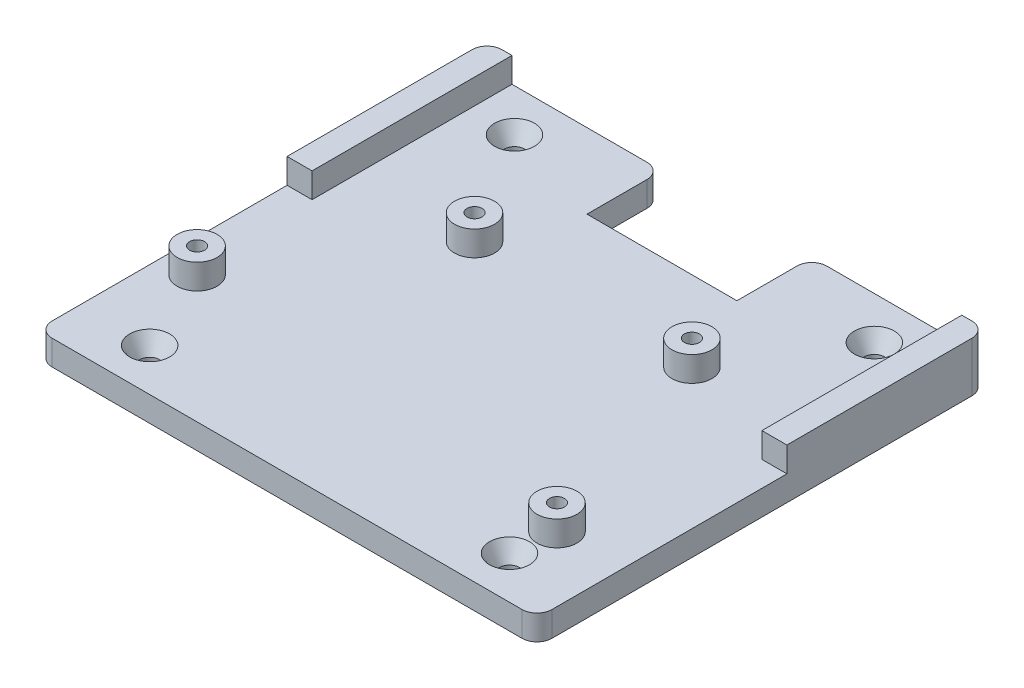
from build123d import *

# Parameters (mm, degrees)
CROQUIS1_R              = 2
SALIENTE_EXTRUIR2_DEPTH = 5
CHAFL_N1_SIZE           = 2
CHAFL_N1_SIZE2          = 3.464101615
CROQUIS3_R              = 4
CROQUIS3_R_2            = 1.5
SALIENTE_EXTRUIR3_DEPTH = 5
CROQUIS4_W              = 5
CROQUIS4_H              = 40
SALIENTE_EXTRUIR4_DEPTH = 5
REDONDEO1_R             = 3


with BuildPart() as part:
    # Croquis1 → Saliente-Extruir2 (new body)
    with BuildSketch(Plane(origin=(0, 0, 0), x_dir=(1, 0, 0), z_dir=(0, 1, 0))):
        Polygon((-50, 45), (-50, -45), (50, -45), (50, 45), (15, 45), (15, 30), (-15, 30), (-15, 45), align=None)
        with Locations(Location((-36, -36.5, 0), (0, 0, 270))):
            Circle(CROQUIS1_R, mode=Mode.SUBTRACT)
        with Locations(Location((-36, 36.5, 0), (0, 0, 270))):
            Circle(CROQUIS1_R, mode=Mode.SUBTRACT)
        with Locations(Location((36, 36.5, 0), (0, 0, 270))):
            Circle(CROQUIS1_R, mode=Mode.SUBTRACT)
        with Locations(Location((36, -36.5, 0), (0, 0, 270))):
            Circle(CROQUIS1_R, mode=Mode.SUBTRACT)
    extrude(amount=SALIENTE_EXTRUIR2_DEPTH)

    # Chaflán1
    chafl_n1_edges = [part.edges().sort_by_distance(p)[0] for p in [
        (-36, 5, 34.5),
        (-36, 5, -38.5),
        (36, 5, -38.5),
        (36, 5, 34.5),
    ]]
    chafl_n1_side = [part.faces().sort_by_distance(p)[0] for p in [
        (0, 5, 1.985356127),
    ]]
    chamfer(chafl_n1_edges, length=CHAFL_N1_SIZE, length2=CHAFL_N1_SIZE2, reference=chafl_n1_side[0])

    # Croquis3 → Saliente-Extruir3 (add)
    # profile 1 of 4: a face of its own
    with BuildSketch(Plane(origin=(0, 5, 0), x_dir=(1, 0, 0), z_dir=(0, 1, 0))):
        with Locations(Location((-43.5, -19.5, 0), (0, 0, 270))):
            Circle(CROQUIS3_R)
        with Locations(Location((-43.5, -19.5, 0), (0, 0, 270))):
            Circle(CROQUIS3_R_2, mode=Mode.SUBTRACT)
    # profile 2 of 4: a face of its own
    with BuildSketch(Plane(origin=(0, 5, 0), x_dir=(1, 0, 0), z_dir=(0, 1, 0))):
        with Locations(Location((37, -28, 0), (0, 0, 270))):
            Circle(CROQUIS3_R)
        with Locations(Location((37, -28, 0), (0, 0, 270))):
            Circle(CROQUIS3_R_2, mode=Mode.SUBTRACT)
    # profile 3 of 4: a face of its own
    with BuildSketch(Plane(origin=(0, 5, 0), x_dir=(1, 0, 0), z_dir=(0, 1, 0))):
        with Locations(Location((22, 14, 0), (0, 0, 270))):
            Circle(CROQUIS3_R)
        with Locations(Location((22, 14, 0), (0, 0, 270))):
            Circle(CROQUIS3_R_2, mode=Mode.SUBTRACT)
    # profile 4 of 4: a face of its own
    with BuildSketch(Plane(origin=(0, 5, 0), x_dir=(1, 0, 0), z_dir=(0, 1, 0))):
        with Locations(Location((-21.5, 14, 0), (0, 0, 270))):
            Circle(CROQUIS3_R)
        with Locations(Location((-21.5, 14, 0), (0, 0, 270))):
            Circle(CROQUIS3_R_2, mode=Mode.SUBTRACT)
    extrude(amount=SALIENTE_EXTRUIR3_DEPTH)

    # Croquis4 → Saliente-Extruir4 (add)
    with BuildSketch(Plane(origin=(0, 5, 0), x_dir=(1, 0, 0), z_dir=(0, 1, 0))):
        with Locations((-47.5, 25)):
            Rectangle(CROQUIS4_W, CROQUIS4_H)
        with Locations((47.5, 25)):
            Rectangle(CROQUIS4_W, CROQUIS4_H)
    extrude(amount=SALIENTE_EXTRUIR4_DEPTH)

    # Redondeo1
    redondeo1_edges = [part.edges().sort_by_distance(p)[0] for p in [
        (50, 2.5, 45),
        (-50, 2.5, 45),
        (-50, 5, -45),
        (-15, 2.5, -45),
        (15, 2.5, -45),
        (50, 5, -45),
    ]]
    fillet(redondeo1_edges, radius=REDONDEO1_R)


solid = part.part
